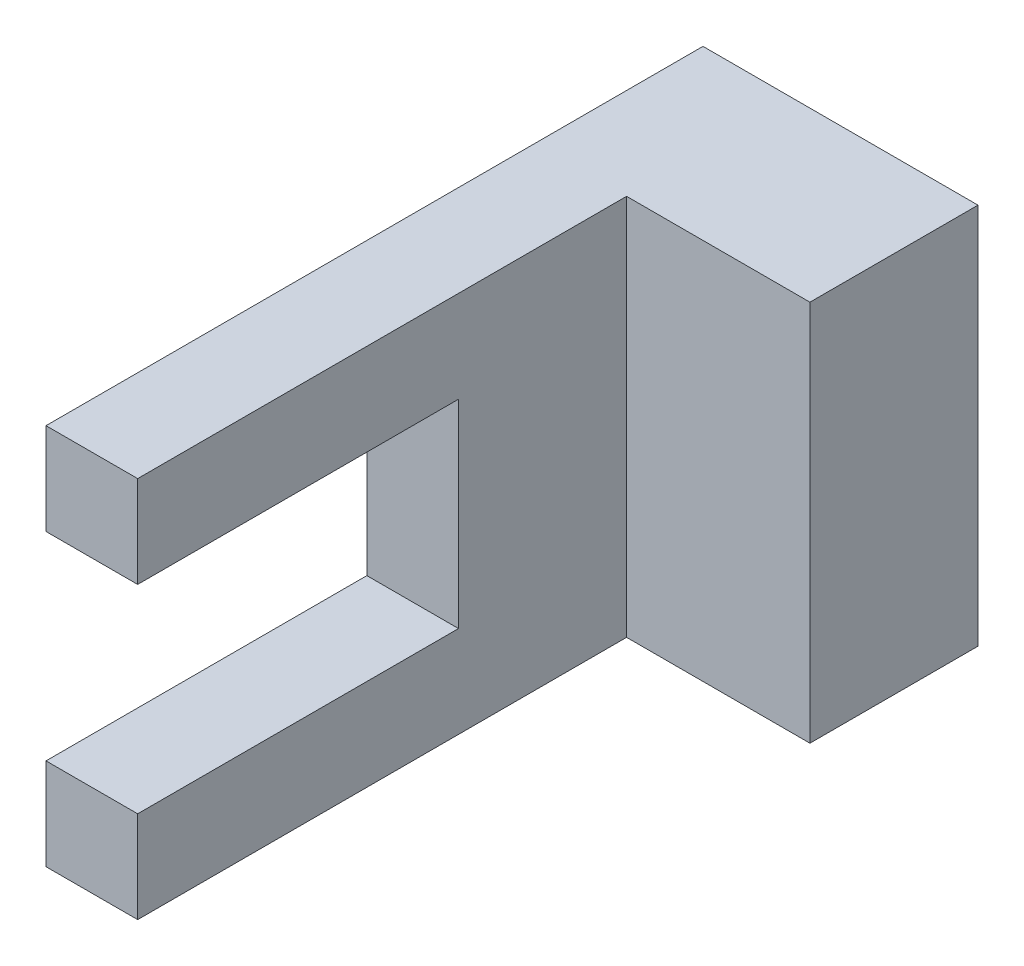
from build123d import *

# Parameters (mm, degrees)
BOSS_EXTRUDE1_DEPTH = 18
SKETCH2_W           = 12
SKETCH2_H           = 25
CUT_EXTRUDE1_DEPTH  = 32


with BuildPart() as part:
    # Sketch1 → Boss-Extrude1 (new body)
    with BuildSketch(Plane(origin=(0, 0, 0), x_dir=(0, 0, -1), z_dir=(1, 0, 0))):
        Polygon((23.590291199, 13.647665727), (-19.409708801, 13.647665727), (-19.409708801, 7.647665727), (1.590291199, 7.647665727), (1.590291199, -5.352334273), (-19.409708801, -5.352334273), (-19.409708801, -11.352334273), (23.590291199, -11.352334273), align=None)
    extrude(amount=BOSS_EXTRUDE1_DEPTH)

    # Sketch2 → Cut-Extrude1 (cut)
    with BuildSketch(Plane.XY.offset(19.409708801)):
        with Locations((12, 1.147665727)):
            Rectangle(SKETCH2_W, SKETCH2_H)
    extrude(amount=-CUT_EXTRUDE1_DEPTH, mode=Mode.SUBTRACT)


solid = part.part
